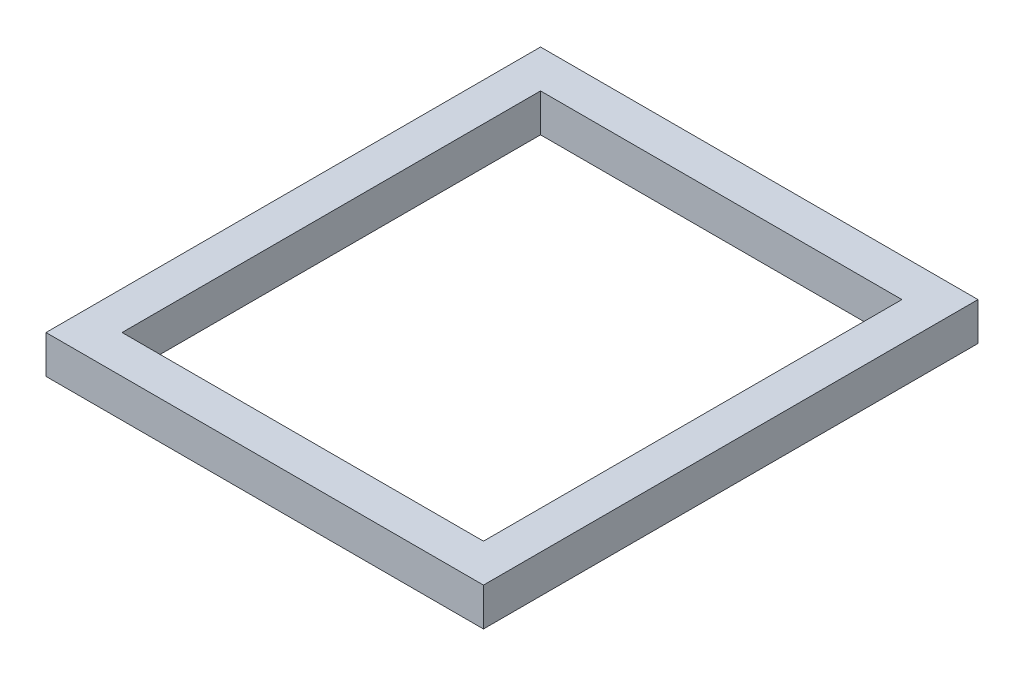
from build123d import *

# Parameters (mm, degrees)
SKETCH1_W           = 73.025
SKETCH1_H           = 82.55
SKETCH1_W_2         = 60.325
SKETCH1_H_2         = 69.85
BOSS_EXTRUDE1_DEPTH = 6.35


with BuildPart() as part:
    # Sketch1 → Boss-Extrude1 (new body)
    with BuildSketch(Plane(origin=(0, 0, 0), x_dir=(1, 0, 0), z_dir=(0, 1, 0))):
        Rectangle(SKETCH1_W, SKETCH1_H)
        Rectangle(SKETCH1_W_2, SKETCH1_H_2, mode=Mode.SUBTRACT)
    extrude(amount=BOSS_EXTRUDE1_DEPTH)


solid = part.part
